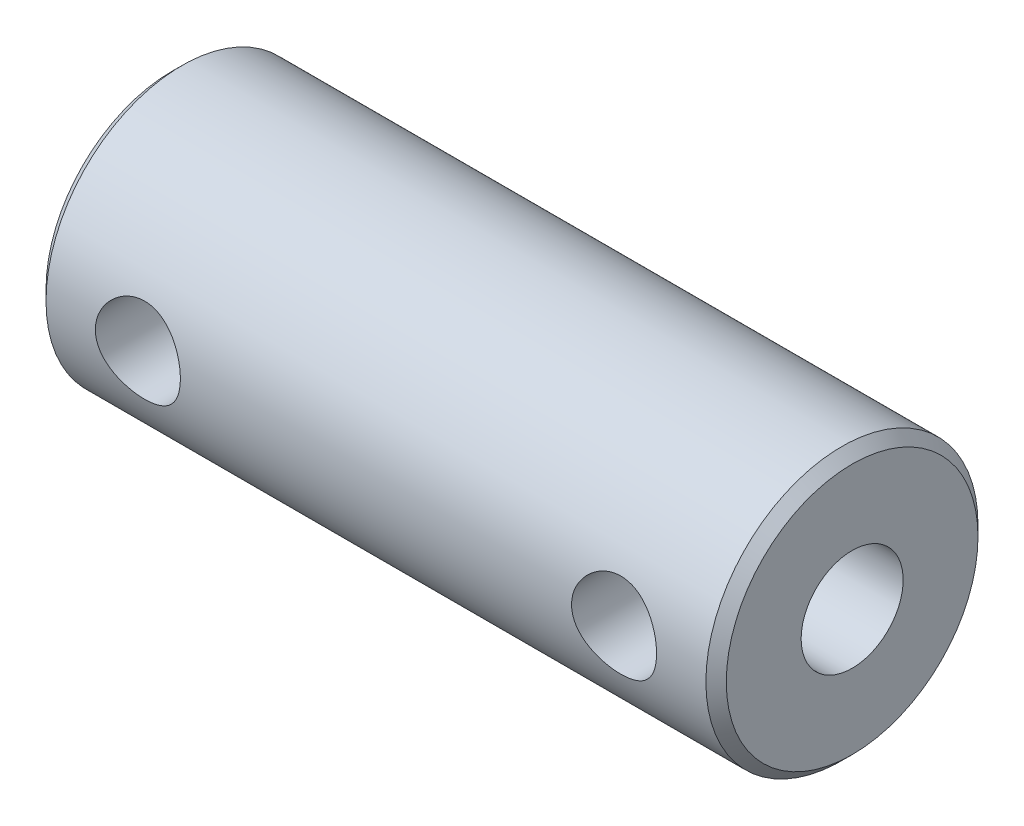
from build123d import *

# Parameters (mm, degrees)
ESQUISSE2_R             = 1.25
ENL_V_MAT_EXTRU_1_DEPTH = 5


with BuildPart() as part:
    # Esquisse1 → Révolution1 (revolve)
    with BuildSketch(Plane.XY, mode=Mode.PRIVATE) as r_volution1_sk:
        Polygon((-10, 3.7), (-10, 2), (0, 2), (0, 1.5), (10, 1.5), (10, 3.7), (9.7, 4), (-9.7, 4), align=None)
    revolve(r_volution1_sk.sketch.rotate(Axis((-9.079951531, 0, 0), (1, 0, 0)), 90), axis=Axis((-9.079951531, 0, 0), (1, 0, 0)))

    # Esquisse2 → Enlèv. mat.-Extru.1 (cut)
    with BuildSketch(Plane.XY.offset(6.1)):
        with Locations((-7, 0)):
            Circle(ESQUISSE2_R)
        with Locations((7, 0)):
            Circle(ESQUISSE2_R)
    extrude(amount=-ENL_V_MAT_EXTRU_1_DEPTH, mode=Mode.SUBTRACT)


solid = part.part
